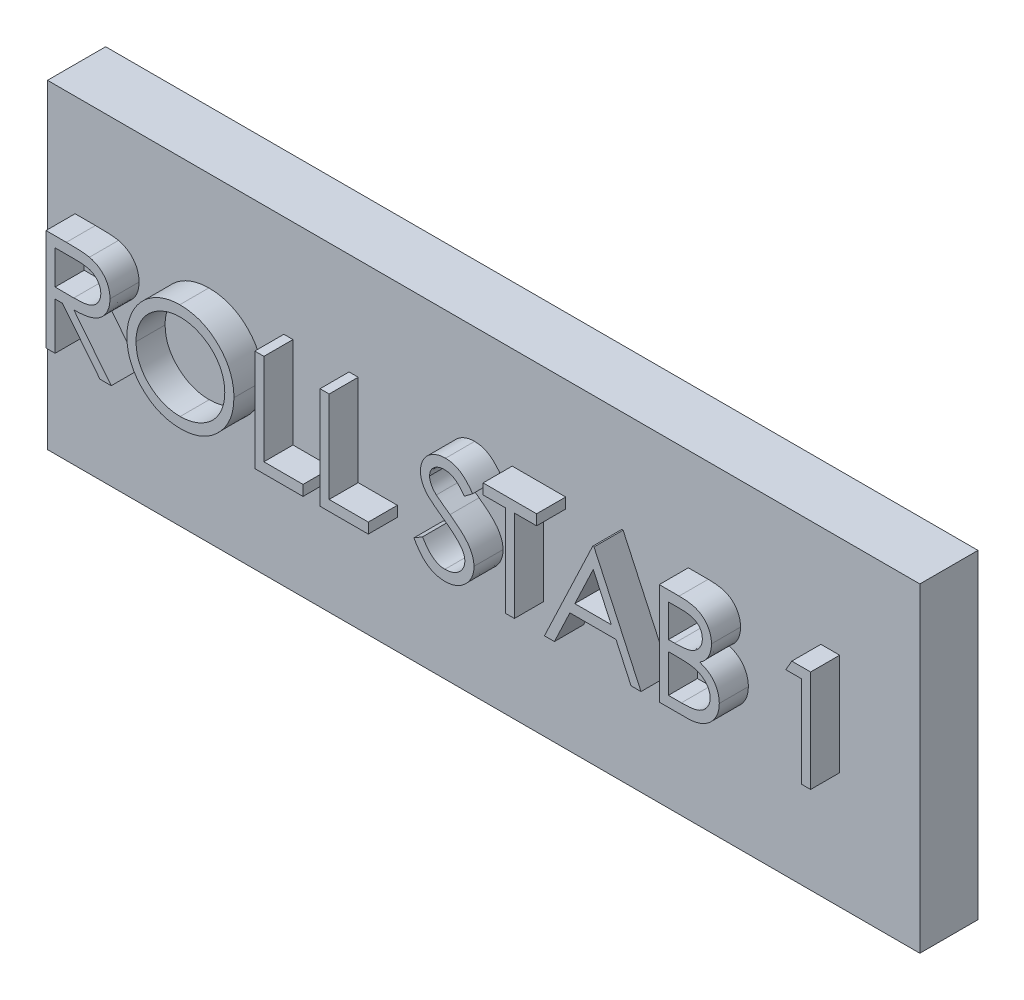
from build123d import *

# Parameters (mm, degrees)
SKETCH1_W           = 30
SKETCH1_H           = 11
BOSS_EXTRUDE1_DEPTH = 2
BOSS_EXTRUDE3_DEPTH = 1


with BuildPart() as part:
    # Sketch1 → Boss-Extrude1 (new body)
    with BuildSketch(Plane.XY):
        with Locations((-36.24, 26.08)):
            Rectangle(SKETCH1_W, SKETCH1_H)
    extrude(amount=BOSS_EXTRUDE1_DEPTH)

    # Sketch3 → Boss-Extrude3 (add)
    # profile 1 of 9: a face of its own
    with BuildSketch(Plane.XY.offset(2)):
        with BuildLine():
            Line((-50.291282051, 28.08), (-49.590861378, 28.08))
            add(Edge.make_bspline(
                [(-49.590861378, 28.08), (-49.54412025, 28.079844414), (-49.454372105, 28.079545672), (-49.325798835, 28.077879909), (-49.208971738, 28.073105553), (-49.103951899, 28.06899697), (-49.010741244, 28.061505028), (-48.929053953, 28.054344381), (-48.859266255, 28.04497072), (-48.817020404, 28.036265297), (-48.797892628, 28.032323718)],
                knots=[0, 0, 0, 0, 1.410062039, 2.707475311, 3.878576406, 4.937260626, 5.877586885, 6.699081471, 7.410979367, 8, 8, 8, 8], degree=3))
            add(Edge.make_bspline(
                [(-48.797892628, 28.032323718), (-48.772286004, 28.025996953), (-48.721619015, 28.013478389), (-48.648668949, 27.987018788), (-48.579154625, 27.956399163), (-48.5133648, 27.920435443), (-48.451629009, 27.878860663), (-48.393310698, 27.832392541), (-48.338145235, 27.781285335), (-48.288363605, 27.724250494), (-48.241424553, 27.664413984), (-48.201835927, 27.599710227), (-48.167709447, 27.5320487), (-48.14053893, 27.460741282), (-48.118660956, 27.38647951), (-48.103234717, 27.308590713), (-48.093983529, 27.227429738), (-48.093041674, 27.17207183), (-48.092564103, 27.144002404)],
                knots=[0, 0, 0, 0, 1.027469482, 2.033020251, 3.019912614, 3.986113645, 4.951240523, 5.91722682, 6.890402269, 7.87763091, 8.8651537, 9.85103654, 10.82876324, 11.815024772, 12.821070561, 13.842952187, 14.906261191, 16, 16, 16, 16], degree=3))
            add(Edge.make_bspline(
                [(-48.092564103, 27.144002404), (-48.094033101, 27.097367299), (-48.096899496, 27.006370131), (-48.1236246, 26.87430925), (-48.16740112, 26.751119935), (-48.227724409, 26.636957297), (-48.304543885, 26.534046652), (-48.396868676, 26.443656197), (-48.504750287, 26.368016284), (-48.605179603, 26.315563479), (-48.693893803, 26.281970571), (-48.766927116, 26.258334212), (-48.846594093, 26.240072247), (-48.932131428, 26.223712115), (-49.023895083, 26.21136042), (-49.121665123, 26.202313826), (-49.225511274, 26.196659777), (-49.296850344, 26.195817772), (-49.333549679, 26.195384615)],
                knots=[0, 0, 0, 0, 1.260483769, 2.459530307, 3.627416485, 4.787058657, 5.939039949, 7.08810263, 8.267026773, 9.491475466, 10.141966685, 10.831826277, 11.566392101, 12.351337768, 13.187381173, 14.07005841, 15.007169909, 16, 16, 16, 16], degree=3))
            Line((-49.333549679, 26.195384615), (-48.047692308, 24.58))
            Line((-48.047692308, 24.58), (-48.436113782, 24.58))
            Line((-48.436113782, 24.58), (-49.721971154, 26.195384615))
            Line((-49.721971154, 26.195384615), (-49.977179487, 26.195384615))
            Line((-49.977179487, 26.195384615), (-49.977179487, 24.58))
            Line((-49.977179487, 24.58), (-50.291282051, 24.58))
            Line((-50.291282051, 24.58), (-50.291282051, 28.08))
        make_face()
        with BuildLine():
            Line((-49.977179487, 27.721025641), (-49.977179487, 26.554358974))
            Line((-49.977179487, 26.554358974), (-49.336354167, 26.549451122))
            add(Edge.make_bspline(
                [(-49.336354167, 26.549451122), (-49.306434128, 26.549437885), (-49.248440571, 26.549412229), (-49.164539906, 26.553406005), (-49.086419794, 26.557949323), (-49.014379042, 26.564898669), (-48.948385467, 26.57385474), (-48.888472053, 26.585057725), (-48.834541002, 26.598109787), (-48.771642463, 26.618311413), (-48.701405932, 26.650317431), (-48.625074472, 26.69688293), (-48.560072134, 26.755452049), (-48.505154272, 26.822425505), (-48.46102484, 26.896061754), (-48.429912786, 26.975478123), (-48.410170344, 27.058669721), (-48.407841798, 27.115847829), (-48.406666667, 27.144703526)],
                knots=[0, 0, 0, 0, 1.146690395, 2.22261258, 3.21895312, 4.145990853, 4.996080663, 5.770904154, 6.481378293, 7.121626537, 8.300444488, 9.431385265, 10.535395872, 11.636531494, 12.74115979, 13.810798291, 14.895190096, 16, 16, 16, 16], degree=3))
            add(Edge.make_bspline(
                [(-48.406666667, 27.144703526), (-48.407868788, 27.172850099), (-48.410250953, 27.228626338), (-48.429699722, 27.310282248), (-48.462589103, 27.387349198), (-48.506911341, 27.459513683), (-48.560910496, 27.525019419), (-48.624228309, 27.581066572), (-48.695133504, 27.627316037), (-48.761404702, 27.656870418), (-48.820638915, 27.674990271), (-48.872068575, 27.687741435), (-48.930180052, 27.697985904), (-48.995255511, 27.706193964), (-49.067017142, 27.713248909), (-49.145827793, 27.718000687), (-49.231164573, 27.720814551), (-49.290311504, 27.72095364), (-49.320929487, 27.721025641)],
                knots=[0, 0, 0, 0, 1.101028733, 2.181837193, 3.264309656, 4.369019818, 5.486613113, 6.575447106, 7.666700264, 8.788928104, 9.402425223, 10.0903467, 10.862060571, 11.710948788, 12.657782767, 13.684531032, 14.801375019, 16, 16, 16, 16], degree=3))
            Line((-49.320929487, 27.721025641), (-49.977179487, 27.721025641))
        make_face(mode=Mode.SUBTRACT)
    # profile 2 of 9: a face of its own
    with BuildSketch(Plane.XY.offset(2)):
        with BuildLine():
            add(Edge.make_bspline(
                [(-45.691923077, 28.16974359), (-45.627114971, 28.16810211), (-45.499826504, 28.164878109), (-45.312751606, 28.140199006), (-45.134156511, 28.097503616), (-44.962586372, 28.040640633), (-44.800093396, 27.964786248), (-44.645454503, 27.8731011), (-44.499037629, 27.764624641), (-44.362816248, 27.640195414), (-44.238159298, 27.50481196), (-44.128333411, 27.36033405), (-44.036291118, 27.207635248), (-43.96070533, 27.047174417), (-43.901406721, 26.879314449), (-43.860487677, 26.703160446), (-43.834349527, 26.519853756), (-43.831293749, 26.394826892), (-43.82974359, 26.331402244)],
                knots=[0, 0, 0, 0, 1.065120563, 2.091984664, 3.0946048, 4.079830382, 5.057816894, 6.036188127, 7.030412546, 8.04752943, 9.064399622, 10.05169764, 11.02544977, 11.989514704, 12.962713494, 13.945757189, 14.957906945, 16, 16, 16, 16], degree=3))
            add(Edge.make_bspline(
                [(-43.82974359, 26.331402244), (-43.831293522, 26.268444797), (-43.834348619, 26.144348377), (-43.860517396, 25.962204933), (-43.901558396, 25.787114236), (-43.960154663, 25.619368583), (-44.035380141, 25.45879102), (-44.128035312, 25.305804066), (-44.237176523, 25.160357567), (-44.361383374, 25.024044902), (-44.496784416, 24.899047431), (-44.642014683, 24.790128556), (-44.793808003, 24.696404431), (-44.954117711, 24.621620757), (-45.120817748, 24.561848837), (-45.295400071, 24.521096207), (-45.477046625, 24.494809163), (-45.600917629, 24.491790647), (-45.663878205, 24.49025641)],
                knots=[0, 0, 0, 0, 1.043624062, 2.057103931, 3.04512605, 4.022047818, 4.998200453, 5.980619268, 6.982898556, 8.009068085, 9.034988726, 10.034168286, 11.015286542, 11.987931943, 12.962482838, 13.94673481, 14.956375938, 16, 16, 16, 16], degree=3))
            add(Edge.make_bspline(
                [(-45.663878205, 24.49025641), (-45.727302524, 24.491805797), (-45.85232874, 24.494860051), (-46.035865775, 24.521041456), (-46.212143519, 24.56198276), (-46.38065787, 24.620492196), (-46.5415028, 24.696109427), (-46.694992883, 24.788313806), (-46.84051203, 24.897720947), (-46.976853777, 25.021887521), (-47.101602975, 25.157059073), (-47.21036235, 25.301893329), (-47.302587464, 25.453548785), (-47.377950796, 25.612446309), (-47.437615256, 25.777817752), (-47.478320074, 25.950766229), (-47.504656026, 26.130305735), (-47.507690872, 26.252548634), (-47.509230769, 26.314575321)],
                knots=[0, 0, 0, 0, 1.053102029, 2.075944431, 3.073151272, 4.055350789, 5.033113405, 6.020478099, 7.024410459, 8.052272461, 9.079885166, 10.07527673, 11.055994387, 12.023226415, 12.992069828, 13.970394897, 14.97016774, 16, 16, 16, 16], degree=3))
            add(Edge.make_bspline(
                [(-47.509230769, 26.314575321), (-47.508696134, 26.35620799), (-47.507633607, 26.438948113), (-47.494841915, 26.561814713), (-47.476280214, 26.682705371), (-47.449678301, 26.801276319), (-47.414886634, 26.917237304), (-47.373834607, 27.031388067), (-47.323694761, 27.14257179), (-47.267014113, 27.251315182), (-47.203752305, 27.355923088), (-47.133876556, 27.454802671), (-47.059841187, 27.548783668), (-46.978677794, 27.635430672), (-46.893061349, 27.717264328), (-46.80160297, 27.793027045), (-46.704860726, 27.863401996), (-46.602418346, 27.926822337), (-46.496800071, 27.984181472), (-46.387923294, 28.033403323), (-46.277266722, 28.075649384), (-46.164312074, 28.109890209), (-46.049359302, 28.136922245), (-45.932157518, 28.155329599), (-45.812800091, 28.168153917), (-45.732388772, 28.169211419), (-45.691923077, 28.16974359)],
                knots=[0, 0, 0, 0, 1.037015668, 2.060948919, 3.074880161, 4.083647147, 5.086022904, 6.090072063, 7.104153813, 8.122640571, 9.144368836, 10.147691507, 11.138137339, 12.123020368, 13.103399296, 14.087645067, 15.080126199, 16.082011238, 17.087798457, 18.072939717, 19.057185487, 20.037253025, 21.01195951, 21.997135196, 22.992090687, 24, 24, 24, 24], degree=3))
        make_face()
        with BuildLine():
            add(Edge.make_bspline(
                [(-45.676498397, 27.810769231), (-45.709713031, 27.810364341), (-45.775824764, 27.809558431), (-45.8741093, 27.798942715), (-45.971101234, 27.783812826), (-46.066820596, 27.762231305), (-46.160866886, 27.732827253), (-46.254116727, 27.698986345), (-46.345719781, 27.657765254), (-46.435373638, 27.61119255), (-46.522288714, 27.559643629), (-46.604301415, 27.502671862), (-46.681624059, 27.441613307), (-46.754067326, 27.37632547), (-46.821418498, 27.306475868), (-46.885003199, 27.233123432), (-46.942272781, 27.154171541), (-46.994758358, 27.071761134), (-47.041726198, 26.985999553), (-47.083491553, 26.897789691), (-47.117655562, 26.806412004), (-47.145517938, 26.712857846), (-47.168617749, 26.617275387), (-47.183251673, 26.518939538), (-47.193984032, 26.418344426), (-47.194743878, 26.350362572), (-47.195128205, 26.315977564)],
                knots=[0, 0, 0, 0, 1.008559885, 2.007477868, 2.99961109, 3.989939068, 4.984837346, 5.991145699, 7.001802488, 8.033829008, 9.059044045, 10.069351652, 11.065060232, 12.050310815, 13.029377138, 14.011219647, 14.996725999, 15.989392538, 16.977580475, 17.965360261, 18.951710183, 19.937753436, 20.929683414, 21.935841486, 22.955955122, 24, 24, 24, 24], degree=3))
            add(Edge.make_bspline(
                [(-47.195128205, 26.315977564), (-47.193853343, 26.265415343), (-47.191345295, 26.165943813), (-47.169387725, 26.020175669), (-47.135565751, 25.880087383), (-47.085708384, 25.746445474), (-47.02335777, 25.618101191), (-46.946330879, 25.496193086), (-46.855071794, 25.380688212), (-46.751408267, 25.272392943), (-46.638085561, 25.173547138), (-46.517752831, 25.08678373), (-46.391699223, 25.01337348), (-46.25959602, 24.953568408), (-46.122148481, 24.90617867), (-45.97847093, 24.873700039), (-45.829520471, 24.852324583), (-45.727989816, 24.850271827), (-45.676498397, 24.849230769)],
                knots=[0, 0, 0, 0, 1.032063989, 2.030389145, 3.003944642, 3.970395727, 4.937377036, 5.913328081, 6.909231446, 7.93887556, 8.970685674, 9.976071282, 10.964166581, 11.944589148, 12.933237628, 13.927779006, 14.949070134, 16, 16, 16, 16], degree=3))
            add(Edge.make_bspline(
                [(-45.676498397, 24.849230769), (-45.641888896, 24.849706274), (-45.573247859, 24.850649342), (-45.471152337, 24.860148018), (-45.370896125, 24.875379888), (-45.272619845, 24.897310543), (-45.176435034, 24.92475775), (-45.081940231, 24.957365478), (-44.990141941, 24.998046682), (-44.899882103, 25.042994633), (-44.813485861, 25.094234791), (-44.731010329, 25.14927294), (-44.654534349, 25.210241561), (-44.582145278, 25.274559374), (-44.514517589, 25.343523221), (-44.452108604, 25.417043443), (-44.395128472, 25.4955841), (-44.342662826, 25.577869506), (-44.295859563, 25.663865759), (-44.255080464, 25.752395437), (-44.220484348, 25.843240546), (-44.192555843, 25.936532118), (-44.170670381, 26.032092966), (-44.155590462, 26.130051045), (-44.145042023, 26.230210387), (-44.144246946, 26.297954243), (-44.143846154, 26.332103365)],
                knots=[0, 0, 0, 0, 1.047197238, 2.076906641, 3.100256066, 4.114471768, 5.12198147, 6.126382909, 7.136867548, 8.15857795, 9.17633901, 10.174870724, 11.156907918, 12.133735059, 13.104061851, 14.077631395, 15.04955518, 16.038496417, 17.029181396, 18.010275684, 18.986308667, 19.968651475, 20.955262928, 21.950658345, 22.966943676, 24, 24, 24, 24], degree=3))
            add(Edge.make_bspline(
                [(-44.143846154, 26.332103365), (-44.144247267, 26.36601887), (-44.145042948, 26.43329652), (-44.155585423, 26.532757338), (-44.170686313, 26.63001055), (-44.192449021, 26.724674353), (-44.220499175, 26.816772878), (-44.255086505, 26.906219625), (-44.295871805, 26.993347821), (-44.342680029, 27.077942118), (-44.395295853, 27.159116855), (-44.452790096, 27.236719268), (-44.516155444, 27.309292009), (-44.583581469, 27.378626703), (-44.656752354, 27.443244593), (-44.735336649, 27.503167114), (-44.818380326, 27.559840388), (-44.906307562, 27.61096595), (-44.997051515, 27.658180182), (-45.090165473, 27.698631186), (-45.184594573, 27.733003305), (-45.280098685, 27.76232027), (-45.377481664, 27.7837283), (-45.476085493, 27.79895635), (-45.575773751, 27.809554736), (-45.642816971, 27.810363114), (-45.676498397, 27.810769231)],
                knots=[0, 0, 0, 0, 1.02996197, 2.043119294, 3.035359645, 4.018872909, 4.991431989, 5.957985074, 6.929999688, 7.912076566, 8.892894881, 9.867085534, 10.843653904, 11.817741046, 12.803660682, 13.806313499, 14.818574707, 15.856120519, 16.894564902, 17.924820532, 18.937903209, 19.946497019, 20.957711757, 21.963978472, 22.977135795, 24, 24, 24, 24], degree=3))
        make_face(mode=Mode.SUBTRACT)
    # profile 3 of 9: a face of its own
    with BuildSketch(Plane.XY.offset(2)):
        Polygon((-43.111794872, 28.08), (-42.797692308, 28.08), (-42.797692308, 24.938974359), (-41.451538462, 24.938974359), (-41.451538462, 24.58), (-43.111794872, 24.58), align=None)
    # profile 4 of 9: a face of its own
    with BuildSketch(Plane.XY.offset(2)):
        Polygon((-40.868205128, 28.08), (-40.554102564, 28.08), (-40.554102564, 24.938974359), (-39.207948718, 24.938974359), (-39.207948718, 24.58), (-40.868205128, 24.58), align=None)
    # profile 5 of 9: a face of its own
    with BuildSketch(Plane.XY.offset(2)):
        with BuildLine():
            Line((-37.637435897, 25.255180288), (-37.3415625, 25.432564103))
            add(Edge.make_bspline(
                [(-37.3415625, 25.432564103), (-37.314044263, 25.386499718), (-37.261320382, 25.298242134), (-37.173369023, 25.178984093), (-37.082236112, 25.077621937), (-36.987246778, 24.994745329), (-36.88898083, 24.929496442), (-36.786796776, 24.883294211), (-36.681038966, 24.854478235), (-36.609065144, 24.850978149), (-36.573133013, 24.849230769)],
                knots=[0, 0, 0, 0, 1.272034388, 2.437168799, 3.508375237, 4.49857839, 5.41946034, 6.295179144, 7.148887113, 8, 8, 8, 8], degree=3))
            add(Edge.make_bspline(
                [(-36.573133013, 24.849230769), (-36.542446152, 24.850085442), (-36.481609379, 24.851779832), (-36.392047136, 24.868060634), (-36.305065334, 24.893072763), (-36.222456696, 24.928893694), (-36.145361082, 24.97223218), (-36.077754386, 25.024578358), (-36.019308273, 25.083184563), (-35.971499159, 25.148567218), (-35.934819123, 25.218884367), (-35.906627055, 25.291060318), (-35.890981981, 25.366228886), (-35.888625228, 25.416839349), (-35.887435897, 25.442379808)],
                knots=[0, 0, 0, 0, 1.095163259, 2.171163733, 3.241058638, 4.321873601, 5.38011039, 6.391990106, 7.366004449, 8.327778327, 9.272591725, 10.192022065, 11.087607919, 12, 12, 12, 12], degree=3))
            add(Edge.make_bspline(
                [(-35.887435897, 25.442379808), (-35.888910208, 25.471520657), (-35.891907266, 25.530759747), (-35.917238746, 25.6181594), (-35.957087993, 25.70465197), (-35.993850637, 25.758153235), (-36.012936699, 25.785929487)],
                knots=[0, 0, 0, 0, 0.938893495, 1.908633276, 2.914225137, 4, 4, 4, 4], degree=3))
            add(Edge.make_bspline(
                [(-36.012936699, 25.785929487), (-36.028607313, 25.805976311), (-36.061505807, 25.848062109), (-36.11806332, 25.910707345), (-36.184429434, 25.975325764), (-36.258332989, 26.044384821), (-36.342466078, 26.114672617), (-36.434193592, 26.189540895), (-36.535857451, 26.266142472), (-36.607156948, 26.317515038), (-36.643946314, 26.344022436)],
                knots=[0, 0, 0, 0, 0.722233717, 1.516239348, 2.393582979, 3.351407094, 4.387010283, 5.505090956, 6.712668013, 8, 8, 8, 8], degree=3))
            add(Edge.make_bspline(
                [(-36.643946314, 26.344022436), (-36.68077031, 26.370251024), (-36.751174987, 26.420398086), (-36.849633569, 26.49482237), (-36.937678032, 26.562866239), (-37.014917049, 26.625170251), (-37.081316646, 26.681742856), (-37.137400057, 26.732040795), (-37.181738614, 26.777424356), (-37.206394194, 26.806865698), (-37.217463942, 26.820084135)],
                knots=[0, 0, 0, 0, 1.452282411, 2.77665338, 3.964542531, 5.026858415, 5.96415736, 6.766646006, 7.446254459, 8, 8, 8, 8], degree=3))
            add(Edge.make_bspline(
                [(-37.217463942, 26.820084135), (-37.232936488, 26.840685171), (-37.263365324, 26.881199875), (-37.30353133, 26.944524733), (-37.337670493, 27.009347998), (-37.364432825, 27.075843863), (-37.386969043, 27.143078792), (-37.402126974, 27.211930038), (-37.411618371, 27.282088656), (-37.412590358, 27.329302157), (-37.413076923, 27.352936699)],
                knots=[0, 0, 0, 0, 1.068054152, 2.10047183, 3.106115577, 4.101338837, 5.06977816, 6.043150881, 7.020423561, 8, 8, 8, 8], degree=3))
            add(Edge.make_bspline(
                [(-37.413076923, 27.352936699), (-37.411771714, 27.389966473), (-37.409189194, 27.463234537), (-37.387348677, 27.570265367), (-37.352875783, 27.672451785), (-37.304580895, 27.768782118), (-37.242323542, 27.856748099), (-37.170277568, 27.937361586), (-37.084466082, 28.005130168), (-36.990313458, 28.064342227), (-36.887257086, 28.110688152), (-36.779266183, 28.145649132), (-36.666169111, 28.16545839), (-36.589565976, 28.168301155), (-36.550697115, 28.16974359)],
                knots=[0, 0, 0, 0, 1.005424448, 1.989358655, 2.955360095, 3.929531133, 4.905563448, 5.876582895, 6.856512386, 7.866279853, 8.892233794, 9.918561126, 10.94386622, 12, 12, 12, 12], degree=3))
            add(Edge.make_bspline(
                [(-36.550697115, 28.16974359), (-36.509453015, 28.168321038), (-36.427431663, 28.165492037), (-36.306782448, 28.140894506), (-36.190621731, 28.100193834), (-36.097178467, 28.054005176), (-36.024045705, 28.00787376), (-35.968272972, 27.965853936), (-35.911755522, 27.917478827), (-35.854037467, 27.862619581), (-35.796096807, 27.80077283), (-35.737073355, 27.732362141), (-35.676829086, 27.657805585), (-35.638073226, 27.604581085), (-35.618205128, 27.577295673)],
                knots=[0, 0, 0, 0, 1.286793592, 2.559021753, 3.825965368, 5.121522368, 5.803751409, 6.523245864, 7.299691795, 8.125521123, 9.008227632, 9.944561021, 10.946284179, 12, 12, 12, 12], degree=3))
            Line((-35.618205128, 27.577295673), (-35.902159455, 27.362051282))
            add(Edge.make_bspline(
                [(-35.902159455, 27.362051282), (-35.919305388, 27.384139972), (-35.952324445, 27.426677626), (-36.002453932, 27.486248941), (-36.049702579, 27.540665421), (-36.096252979, 27.587930549), (-36.139646611, 27.630632682), (-36.181763653, 27.667192439), (-36.221998004, 27.697968034), (-36.272714915, 27.730811594), (-36.336432633, 27.763368098), (-36.416417169, 27.790917176), (-36.500003444, 27.807472238), (-36.556933076, 27.809661126), (-36.585753205, 27.810769231)],
                knots=[0, 0, 0, 0, 1.181633172, 2.275549214, 3.290209073, 4.226197932, 5.078386478, 5.862611352, 6.581680152, 7.217281963, 8.414376989, 9.595101626, 10.782541182, 12, 12, 12, 12], degree=3))
            add(Edge.make_bspline(
                [(-36.585753205, 27.810769231), (-36.621909728, 27.809557531), (-36.691634175, 27.807220882), (-36.790624411, 27.781700896), (-36.879718336, 27.741519036), (-36.956270901, 27.685204058), (-37.020007878, 27.618483065), (-37.066113337, 27.54170421), (-37.093863502, 27.456921808), (-37.097249781, 27.397780151), (-37.098974359, 27.367660256)],
                knots=[0, 0, 0, 0, 1.14458467, 2.207223713, 3.21896685, 4.227309161, 5.202851033, 6.127160689, 7.046193047, 8, 8, 8, 8], degree=3))
            add(Edge.make_bspline(
                [(-37.098974359, 27.367660256), (-37.098581232, 27.348908778), (-37.097794336, 27.311375158), (-37.086819539, 27.255923736), (-37.07272021, 27.200612397), (-37.050377578, 27.145689814), (-37.019532274, 27.090195455), (-36.979027098, 27.033173718), (-36.928013786, 26.974122009), (-36.888936774, 26.935714635), (-36.868305288, 26.915436699)],
                knots=[0, 0, 0, 0, 0.858281714, 1.717966888, 2.583508476, 3.4729293, 4.427298488, 5.488583878, 6.674047936, 8, 8, 8, 8], degree=3))
            add(Edge.make_bspline(
                [(-36.868305288, 26.915436699), (-36.860643916, 26.908599673), (-36.842442249, 26.892356465), (-36.809166323, 26.865764184), (-36.765223525, 26.832961412), (-36.711761324, 26.792374095), (-36.647793962, 26.745292633), (-36.573314406, 26.692319021), (-36.489152873, 26.631733562), (-36.429430957, 26.589376021), (-36.397852564, 26.566979167)],
                knots=[0, 0, 0, 0, 0.420754252, 0.999615792, 1.744751191, 2.668019286, 3.750313428, 4.999500688, 6.413464383, 8, 8, 8, 8], degree=3))
            add(Edge.make_bspline(
                [(-36.397852564, 26.566979167), (-36.359866651, 26.539337807), (-36.286312194, 26.485814145), (-36.181654615, 26.405398465), (-36.086760806, 26.326750697), (-36.001297603, 26.25037309), (-35.924420694, 26.176844997), (-35.856982974, 26.105281816), (-35.798297293, 26.036196244), (-35.735118075, 25.947623668), (-35.670560255, 25.838842584), (-35.615118748, 25.705564345), (-35.580160401, 25.571768025), (-35.575588885, 25.481841188), (-35.573333333, 25.437471955)],
                knots=[0, 0, 0, 0, 1.163667725, 2.253281268, 3.268753668, 4.215851969, 5.092017293, 5.902905408, 6.650798638, 7.335211899, 8.59617414, 9.77448103, 10.901945474, 12, 12, 12, 12], degree=3))
            add(Edge.make_bspline(
                [(-35.573333333, 25.437471955), (-35.573990471, 25.40609359), (-35.575291987, 25.343946206), (-35.5902529, 25.25269113), (-35.612172565, 25.16406026), (-35.645209799, 25.079149147), (-35.685532958, 24.996404385), (-35.736699206, 24.917996484), (-35.79600689, 24.842190086), (-35.864040655, 24.771006594), (-35.938486558, 24.705660398), (-36.017170252, 24.647531337), (-36.100220525, 24.599063014), (-36.187186842, 24.559512172), (-36.278089178, 24.528578654), (-36.372896962, 24.506165785), (-36.471766474, 24.492410074), (-36.538966955, 24.490982313), (-36.573133013, 24.49025641)],
                knots=[0, 0, 0, 0, 0.983748083, 1.948392443, 2.894712957, 3.844097841, 4.80183111, 5.778335162, 6.776009319, 7.81870978, 8.863265674, 9.881300176, 10.883814829, 11.87499822, 12.874611388, 13.892143829, 14.928324115, 16, 16, 16, 16], degree=3))
            add(Edge.make_bspline(
                [(-36.573133013, 24.49025641), (-36.599568356, 24.490767592), (-36.652106116, 24.491783517), (-36.729815598, 24.500764798), (-36.805955187, 24.513471901), (-36.879569469, 24.533645971), (-36.951606881, 24.558122948), (-37.021754115, 24.588261281), (-37.090045169, 24.624378482), (-37.156862752, 24.665673507), (-37.222036926, 24.713731252), (-37.284956394, 24.769704748), (-37.34768558, 24.832050253), (-37.408372976, 24.902460816), (-37.468246121, 24.979798899), (-37.52612453, 25.064788083), (-37.583206248, 25.156965436), (-37.619021716, 25.221830522), (-37.637435897, 25.255180288)],
                knots=[0, 0, 0, 0, 0.915332311, 1.819136955, 2.706846663, 3.586547465, 4.459518054, 5.340707479, 6.227863349, 7.133153174, 8.059268498, 9.028702269, 10.047606654, 11.120612155, 12.245963614, 13.433783089, 14.680604001, 16, 16, 16, 16], degree=3))
        make_face()
    # profile 6 of 9: a face of its own
    with BuildSketch(Plane.XY.offset(2)):
        Polygon((-35.259230769, 27.721025641), (-35.259230769, 28.08), (-33.419487179, 28.08), (-33.419487179, 27.721025641), (-34.182307692, 27.721025641), (-34.182307692, 24.58), (-34.496410256, 24.58), (-34.496410256, 27.721025641), align=None)
    # profile 7 of 9: a face of its own
    with BuildSketch(Plane.XY.offset(2)):
        Polygon((-31.445128205, 28.08), (-29.82974359, 24.58), (-30.171189904, 24.58), (-30.688617788, 25.701794872), (-32.27525641, 25.701794872), (-32.807407853, 24.58), (-33.15025641, 24.58), (-31.49, 28.08), align=None)
        Polygon((-31.471069712, 27.397808494), (-32.104883814, 26.060769231), (-30.854082532, 26.060769231), align=None, mode=Mode.SUBTRACT)
    # profile 8 of 9: a face of its own
    with BuildSketch(Plane.XY.offset(2)):
        with BuildLine():
            Line((-29.201538462, 28.08), (-28.518645833, 28.08))
            add(Edge.make_bspline(
                [(-28.518645833, 28.08), (-28.485217355, 28.07982425), (-28.420424645, 28.079483602), (-28.326205203, 28.07420047), (-28.237956392, 28.066996801), (-28.15565262, 28.055566708), (-28.079331918, 28.041774931), (-28.00876428, 28.025073115), (-27.944174108, 28.005046501), (-27.867061372, 27.97320022), (-27.779140711, 27.925877051), (-27.683942318, 27.855948486), (-27.602538079, 27.770416023), (-27.532351762, 27.673933368), (-27.476550642, 27.567797596), (-27.436181345, 27.454538407), (-27.410623469, 27.335616665), (-27.407995035, 27.253973487), (-27.406666667, 27.21271234)],
                knots=[0, 0, 0, 0, 1.001505555, 1.941167018, 2.826882275, 3.653841531, 4.429895133, 5.150066043, 5.825578002, 6.45369114, 7.647487171, 8.808567382, 9.977351308, 11.170798116, 12.373658725, 13.556498008, 14.765093433, 16, 16, 16, 16], degree=3))
            add(Edge.make_bspline(
                [(-27.406666667, 27.21271234), (-27.407759885, 27.174059784), (-27.409908162, 27.098103867), (-27.430450922, 26.987009758), (-27.46261159, 26.881258539), (-27.507316839, 26.781236154), (-27.565418836, 26.68920254), (-27.634277154, 26.604415274), (-27.717353957, 26.530464217), (-27.779597197, 26.489121315), (-27.811213942, 26.468120994)],
                knots=[0, 0, 0, 0, 1.044552857, 2.05264487, 3.044412934, 4.028983338, 5.005914585, 5.980388656, 6.974128949, 8, 8, 8, 8], degree=3))
            add(Edge.make_bspline(
                [(-27.811213942, 26.468120994), (-27.771453515, 26.452855995), (-27.695381967, 26.42365027), (-27.590695955, 26.372014806), (-27.50050111, 26.315852696), (-27.424103964, 26.254520846), (-27.358766309, 26.188412035), (-27.301713367, 26.116556921), (-27.253031993, 26.038018163), (-27.21131907, 25.953614627), (-27.178770314, 25.864208159), (-27.154394409, 25.770637383), (-27.14042696, 25.673237828), (-27.138439319, 25.606952448), (-27.137435897, 25.573489583)],
                knots=[0, 0, 0, 0, 1.27268992, 2.434971085, 3.483601985, 4.442670788, 5.356604649, 6.2567628, 7.179492994, 8.113709626, 9.066344395, 10.018646069, 10.999752585, 12, 12, 12, 12], degree=3))
            add(Edge.make_bspline(
                [(-27.137435897, 25.573489583), (-27.138412743, 25.539322711), (-27.140334715, 25.472098433), (-27.154514687, 25.373343299), (-27.178523794, 25.278968352), (-27.211594941, 25.188363169), (-27.254757255, 25.101703035), (-27.307285219, 25.018889771), (-27.369916783, 24.94075544), (-27.439979652, 24.866431817), (-27.519241798, 24.79960403), (-27.604757552, 24.740088323), (-27.697603872, 24.691142261), (-27.796255866, 24.650026239), (-27.901820182, 24.618619041), (-28.01382279, 24.596646467), (-28.132167092, 24.58184143), (-28.213376843, 24.580624225), (-28.255024038, 24.58)],
                knots=[0, 0, 0, 0, 0.978564426, 1.925352924, 2.850884081, 3.763762016, 4.682927383, 5.618979971, 6.567305752, 7.547517671, 8.540179244, 9.531824382, 10.526200242, 11.540722885, 12.589160233, 13.674978461, 14.80764778, 16, 16, 16, 16], degree=3))
            Line((-28.255024038, 24.58), (-29.201538462, 24.58))
            Line((-29.201538462, 24.58), (-29.201538462, 28.08))
        make_face()
        with BuildLine():
            Line((-28.887435897, 27.721025641), (-28.887435897, 26.599230769))
            Line((-28.887435897, 26.599230769), (-28.676398237, 26.599230769))
            add(Edge.make_bspline(
                [(-28.676398237, 26.599230769), (-28.645549442, 26.599630692), (-28.585943283, 26.600403425), (-28.499623386, 26.602616942), (-28.419498368, 26.608814985), (-28.345706535, 26.615011248), (-28.278364091, 26.625085835), (-28.217620229, 26.637077958), (-28.162521632, 26.649760863), (-28.098982087, 26.67133035), (-28.026909138, 26.703208025), (-27.950076034, 26.752679861), (-27.882341565, 26.811604215), (-27.825144377, 26.879595176), (-27.778332906, 26.954461362), (-27.745819191, 27.035008243), (-27.723771907, 27.119228375), (-27.721780376, 27.177046627), (-27.720769231, 27.206402244)],
                knots=[0, 0, 0, 0, 1.156816544, 2.235205308, 3.236616184, 4.169592532, 5.011045266, 5.787822928, 6.49130361, 7.128639758, 8.301311294, 9.436451833, 10.541879658, 11.654887649, 12.756523258, 13.837046038, 14.901820046, 16, 16, 16, 16], degree=3))
            add(Edge.make_bspline(
                [(-27.720769231, 27.206402244), (-27.721295411, 27.225828015), (-27.722327571, 27.263933787), (-27.730780873, 27.319483141), (-27.745148448, 27.371726894), (-27.763602741, 27.421381004), (-27.78939143, 27.466892854), (-27.819754893, 27.50983605), (-27.856440583, 27.548748169), (-27.898197896, 27.585117667), (-27.946206519, 27.617362195), (-28.000437811, 27.645602958), (-28.061625488, 27.668343735), (-28.128738343, 27.688259887), (-28.20280943, 27.702248181), (-28.282983984, 27.713901569), (-28.369918703, 27.719834311), (-28.430063805, 27.720619673), (-28.461153846, 27.721025641)],
                knots=[0, 0, 0, 0, 0.91205012, 1.789085906, 2.630437955, 3.453916878, 4.269457761, 5.079663411, 5.91843418, 6.774407191, 7.675494373, 8.627863946, 9.638891023, 10.736472738, 11.911756761, 13.175263542, 14.539845004, 16, 16, 16, 16], degree=3))
            Line((-28.461153846, 27.721025641), (-28.887435897, 27.721025641))
        make_face(mode=Mode.SUBTRACT)
        with BuildLine():
            Line((-28.887435897, 26.24025641), (-28.887435897, 24.938974359))
            Line((-28.887435897, 24.938974359), (-28.440120192, 24.938974359))
            add(Edge.make_bspline(
                [(-28.440120192, 24.938974359), (-28.408101266, 24.939358106), (-28.346389008, 24.940097729), (-28.257287778, 24.942512283), (-28.174704674, 24.948004559), (-28.099016538, 24.956650409), (-28.029406086, 24.966028858), (-27.966708383, 24.978640139), (-27.910415189, 24.993089099), (-27.845140881, 25.015423272), (-27.771637373, 25.050119743), (-27.692426517, 25.102433969), (-27.622000298, 25.164757277), (-27.562195039, 25.236888191), (-27.513182051, 25.315319518), (-27.477526596, 25.398464868), (-27.455535739, 25.484950395), (-27.45287357, 25.543917108), (-27.451538462, 25.573489583)],
                knots=[0, 0, 0, 0, 1.160039823, 2.235823828, 3.228722157, 4.157150951, 4.99529583, 5.772374946, 6.472645482, 7.099169577, 8.269452708, 9.405989375, 10.527446681, 11.663510218, 12.788923519, 13.866172445, 14.929861265, 16, 16, 16, 16], degree=3))
            add(Edge.make_bspline(
                [(-27.451538462, 25.573489583), (-27.451814566, 25.591982924), (-27.452362321, 25.628671306), (-27.460622936, 25.682587125), (-27.472636806, 25.734812998), (-27.48816824, 25.785490739), (-27.510787707, 25.833704115), (-27.537194252, 25.880406674), (-27.568155653, 25.925660154), (-27.616399819, 25.982872407), (-27.686571804, 26.04878942), (-27.786278579, 26.113326923), (-27.899650877, 26.16537473), (-27.98187837, 26.187474206), (-28.024354968, 26.198890224)],
                knots=[0, 0, 0, 0, 0.723448775, 1.435228256, 2.130040452, 2.821711965, 3.505591119, 4.210454504, 4.921174351, 5.648778258, 7.137944449, 8.670945889, 10.280296675, 12, 12, 12, 12], degree=3))
            add(Edge.make_bspline(
                [(-28.024354968, 26.198890224), (-28.041384064, 26.202345308), (-28.078306656, 26.209836643), (-28.138514237, 26.217744346), (-28.207250105, 26.224789406), (-28.284672983, 26.230000564), (-28.370880824, 26.235387107), (-28.466057743, 26.237481929), (-28.569815057, 26.239981189), (-28.64180743, 26.240162323), (-28.679202724, 26.24025641)],
                knots=[0, 0, 0, 0, 0.634451884, 1.375622551, 2.216452059, 3.157844607, 4.20941857, 5.370758133, 6.634282058, 8, 8, 8, 8], degree=3))
            Line((-28.679202724, 26.24025641), (-28.887435897, 26.24025641))
        make_face(mode=Mode.SUBTRACT)
    # profile 9 of 9: a face of its own
    with BuildSketch(Plane.XY.offset(2)):
        Polygon((-24.643545673, 28.08), (-23.996410256, 28.08), (-23.996410256, 24.58), (-24.310512821, 24.58), (-24.310512821, 27.721025641), (-24.848974359, 27.721025641), align=None)
    extrude(amount=BOSS_EXTRUDE3_DEPTH)


solid = part.part
